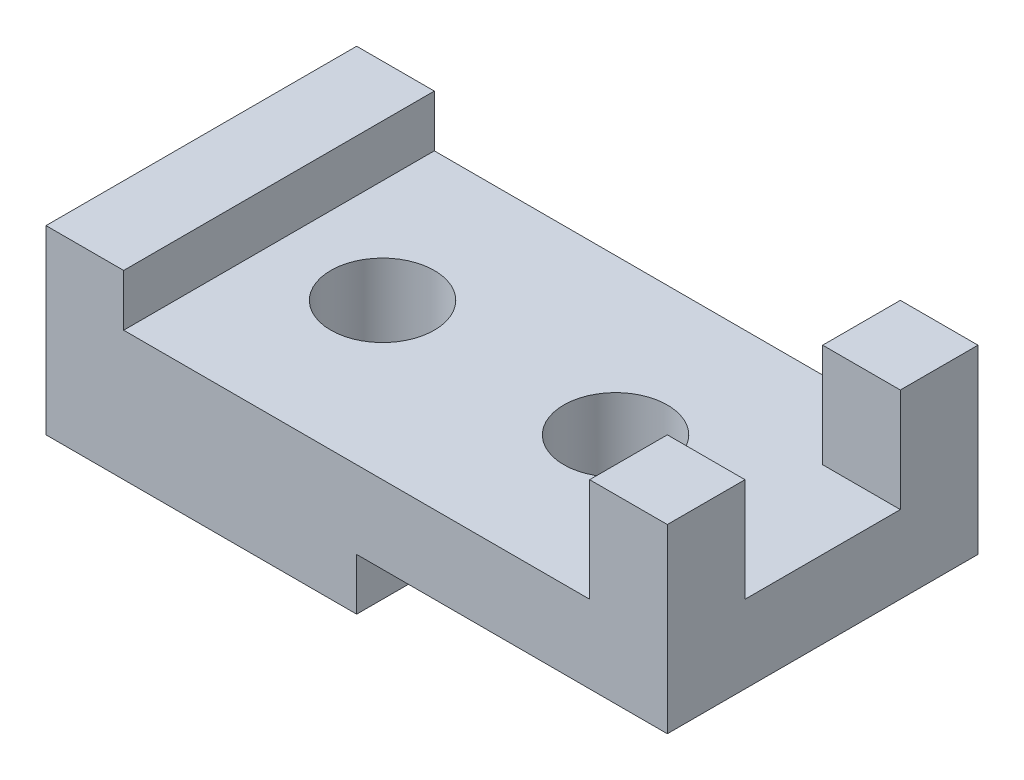
from build123d import *

# Parameters (mm, degrees)
SKETCH2_W                      = 120
SKETCH2_H                      = 35
BOSS_EXTRUDE2_DEPTH            = 30
CUT_EXTRUDE1_REACH             = 71.327
SKETCH3_W                      = 90
SKETCH3_H                      = 10
SKETCH3_W_2                    = 60
CUT_EXTRUDE1_DIRECTION_2_REACH = 71.327
CUT_EXTRUDE3_REACH             = 73.589
SKETCH5_R                      = 10
SKETCH6_W                      = 15
SKETCH6_H                      = 60
BOSS_EXTRUDE3_DEPTH            = 10
CUT_EXTRUDE4_REACH             = 128.713
SKETCH7_W                      = 30
SKETCH7_H                      = 20


with BuildPart() as part:
    # Sketch2 → Boss-Extrude2 (new, symmetric)
    with BuildSketch(Plane.XY):
        Rectangle(SKETCH2_W, SKETCH2_H)
    extrude(amount=BOSS_EXTRUDE2_DEPTH, both=True)

    # Sketch3 → Cut-Extrude1 (cut, up to next)
    with BuildSketch(Plane.XY, mode=Mode.PRIVATE) as cut_extrude1_sk1:
        with Locations((0, 12.5)):
            Rectangle(SKETCH3_W, SKETCH3_H)
    cut_extrude1_tool1 = extrude(cut_extrude1_sk1.sketch, amount=-CUT_EXTRUDE1_REACH, mode=Mode.PRIVATE) & part.part
    # Sketch3 → Cut-Extrude1 (cut, up to next)
    with BuildSketch(Plane.XY, mode=Mode.PRIVATE) as cut_extrude1_sk2:
        with Locations((30, -12.5)):
            Rectangle(SKETCH3_W_2, SKETCH3_H)
    cut_extrude1_tool2 = extrude(cut_extrude1_sk2.sketch, amount=-CUT_EXTRUDE1_REACH, mode=Mode.PRIVATE) & part.part
    add(cut_extrude1_tool1.solids().sort_by_distance((0, 12.5, 0))[0], mode=Mode.SUBTRACT)
    add(cut_extrude1_tool2.solids().sort_by_distance((30, -12.5, 0))[0], mode=Mode.SUBTRACT)

    # Sketch3 → Cut-Extrude1 direction 2 (cut, up to next)
    with BuildSketch(Plane.XY, mode=Mode.PRIVATE) as cut_extrude1_direction_2_sk1:
        with Locations((0, 12.5)):
            Rectangle(SKETCH3_W, SKETCH3_H)
    cut_extrude1_direction_2_tool1 = extrude(cut_extrude1_direction_2_sk1.sketch, amount=CUT_EXTRUDE1_DIRECTION_2_REACH, mode=Mode.PRIVATE) & part.part
    # Sketch3 → Cut-Extrude1 direction 2 (cut, up to next)
    with BuildSketch(Plane.XY, mode=Mode.PRIVATE) as cut_extrude1_direction_2_sk2:
        with Locations((30, -12.5)):
            Rectangle(SKETCH3_W_2, SKETCH3_H)
    cut_extrude1_direction_2_tool2 = extrude(cut_extrude1_direction_2_sk2.sketch, amount=CUT_EXTRUDE1_DIRECTION_2_REACH, mode=Mode.PRIVATE) & part.part
    add(cut_extrude1_direction_2_tool1.solids().sort_by_distance((0, 12.5, 0))[0], mode=Mode.SUBTRACT)
    add(cut_extrude1_direction_2_tool2.solids().sort_by_distance((30, -12.5, 0))[0], mode=Mode.SUBTRACT)

    # Sketch5 → Cut-Extrude3 (cut, up to next)
    with BuildSketch(Plane(origin=(0, 7.5, 0), x_dir=(1, 0, 0), z_dir=(0, 1, 0)), mode=Mode.PRIVATE) as cut_extrude3_sk1:
        with Locations(Location((-25, 0, 0), (0, 0, 270))):
            Circle(SKETCH5_R)
    cut_extrude3_tool1 = extrude(cut_extrude3_sk1.sketch, amount=-CUT_EXTRUDE3_REACH, mode=Mode.PRIVATE) & part.part
    # Sketch5 → Cut-Extrude3 (cut, up to next)
    with BuildSketch(Plane(origin=(0, 7.5, 0), x_dir=(1, 0, 0), z_dir=(0, 1, 0)), mode=Mode.PRIVATE) as cut_extrude3_sk2:
        with Locations(Location((20, 0, 0), (0, 0, 270))):
            Circle(SKETCH5_R)
    cut_extrude3_tool2 = extrude(cut_extrude3_sk2.sketch, amount=-CUT_EXTRUDE3_REACH, mode=Mode.PRIVATE) & part.part
    add(cut_extrude3_tool1.solids().sort_by_distance((-25, 7.5, 0))[0], mode=Mode.SUBTRACT)
    add(cut_extrude3_tool2.solids().sort_by_distance((20, 7.5, 0))[0], mode=Mode.SUBTRACT)

    # Sketch6 → Boss-Extrude3 (add)
    with BuildSketch(Plane(origin=(0, 17.5, 0), x_dir=(1, 0, 0), z_dir=(0, 1, 0))):
        with Locations((52.5, 0)):
            Rectangle(SKETCH6_W, SKETCH6_H)
    extrude(amount=BOSS_EXTRUDE3_DEPTH)

    # Sketch7 → Cut-Extrude4 (cut, up to next)
    with BuildSketch(Plane(origin=(60, 0, 0), x_dir=(0, 0, -1), z_dir=(1, 0, 0)), mode=Mode.PRIVATE) as cut_extrude4_sk1:
        with Locations((0, 17.5)):
            Rectangle(SKETCH7_W, SKETCH7_H)
    cut_extrude4_tool1 = extrude(cut_extrude4_sk1.sketch, amount=-CUT_EXTRUDE4_REACH, mode=Mode.PRIVATE) & part.part
    add(cut_extrude4_tool1.solids().sort_by_distance((60, 17.5, 0))[0], mode=Mode.SUBTRACT)


solid = part.part
